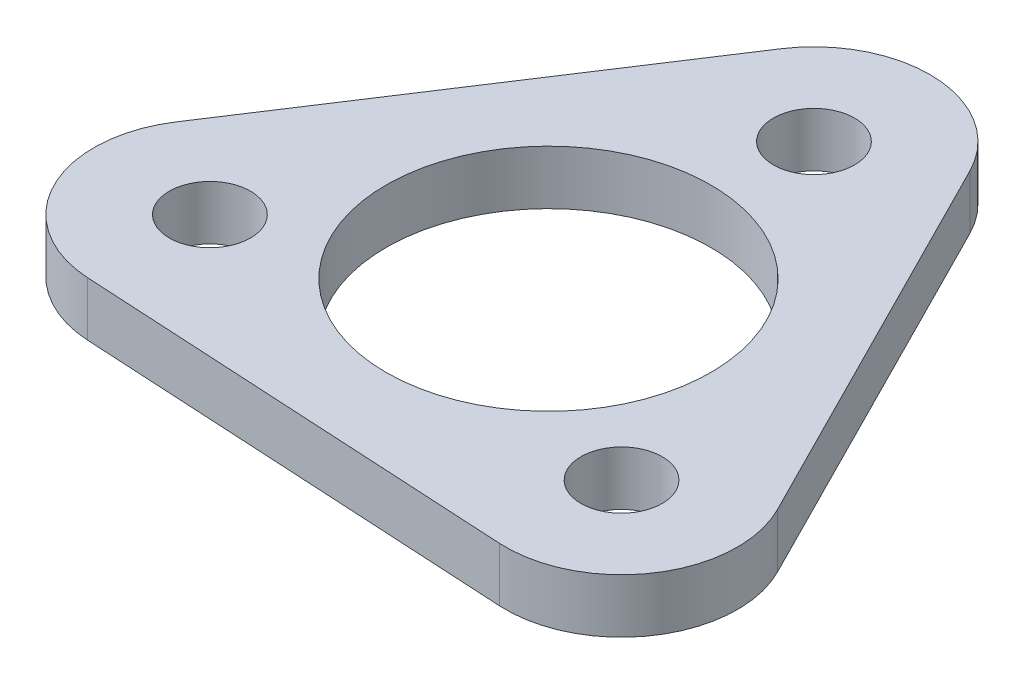
from build123d import *

# Parameters (mm, degrees)
CROQUIS1_R              = 0.6
CROQUIS1_R_2            = 0.15
SALIENTE_EXTRUIR1_DEPTH = 0.2


with BuildPart() as part:
    # Croquis1 → Saliente-Extruir1 (new body)
    with BuildSketch(Plane(origin=(0, 0, 0), x_dir=(1, 0, 0), z_dir=(0, 1, 0))):
        with BuildLine():
            Line((-0.854355723, -0.848184013), (0.755644277, -0.937198778))
            ThreePointArc((0.755644277, -0.937198778), (1.13806739, -0.743726182), (1.161726764, -0.315801754))
            Line((1.161726764, -0.315801754), (0.433815811, 1.123006529))
            ThreePointArc((0.433815811, 1.123006529), (0.075052072, 1.357458362), (-0.307371041, 1.163985767))
            Line((-0.307371041, 1.163985767), (-1.189460088, -0.185807751))
            ThreePointArc((-1.189460088, -0.185807751), (-1.213119462, -0.61373218), (-0.854355723, -0.848184013))
        make_face()
        with Locations(Location((0, 0, 0), (0, 0, 270))):
            Circle(CROQUIS1_R, mode=Mode.SUBTRACT)
        with Locations(Location((0.051392698, 0.929533933, 0), (0, 0, 270))):
            Circle(CROQUIS1_R_2, mode=Mode.SUBTRACT)
        with Locations(Location((0.779303651, -0.509274349, 0), (0, 0, 270))):
            Circle(CROQUIS1_R_2, mode=Mode.SUBTRACT)
        with Locations(Location((-0.830696349, -0.420259585, 0), (0, 0, 270))):
            Circle(CROQUIS1_R_2, mode=Mode.SUBTRACT)
    extrude(amount=SALIENTE_EXTRUIR1_DEPTH)


solid = part.part
